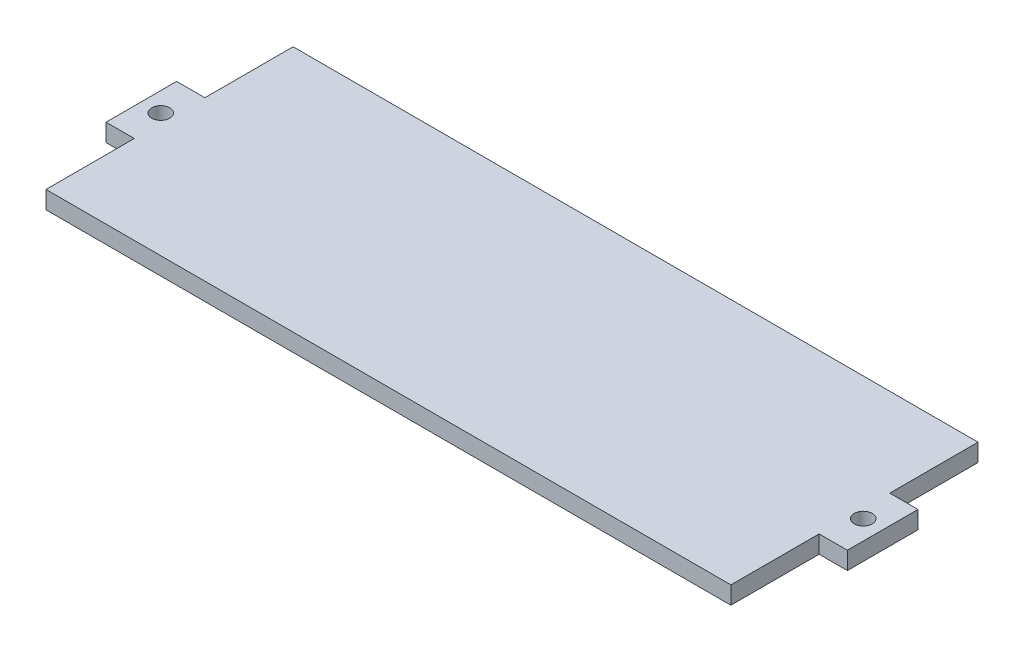
from build123d import *

# Parameters (mm, degrees)
SKETCH1_R           = 1.6256
BOSS_EXTRUDE1_DEPTH = 3.175


with BuildPart() as part:
    # Sketch1 → Boss-Extrude1 (new body)
    with BuildSketch(Plane(origin=(0, 0, 0), x_dir=(1, 0, 0), z_dir=(0, 1, 0))):
        Polygon((0, 28.575), (0, 44.45), (123.19, 44.45), (123.19, 28.575), (128.27, 28.575), (128.27, 15.875), (123.19, 15.875), (123.19, 0), (0, 0), (0, 15.875), (-5.08, 15.875), (-5.08, 28.575), align=None)
        with Locations(Location((-1.5875, 22.225, 0), (0, 0, 270))):
            Circle(SKETCH1_R, mode=Mode.SUBTRACT)
        with Locations(Location((124.7775, 22.225, 0), (0, 0, 270))):
            Circle(SKETCH1_R, mode=Mode.SUBTRACT)
    extrude(amount=BOSS_EXTRUDE1_DEPTH)


solid = part.part
